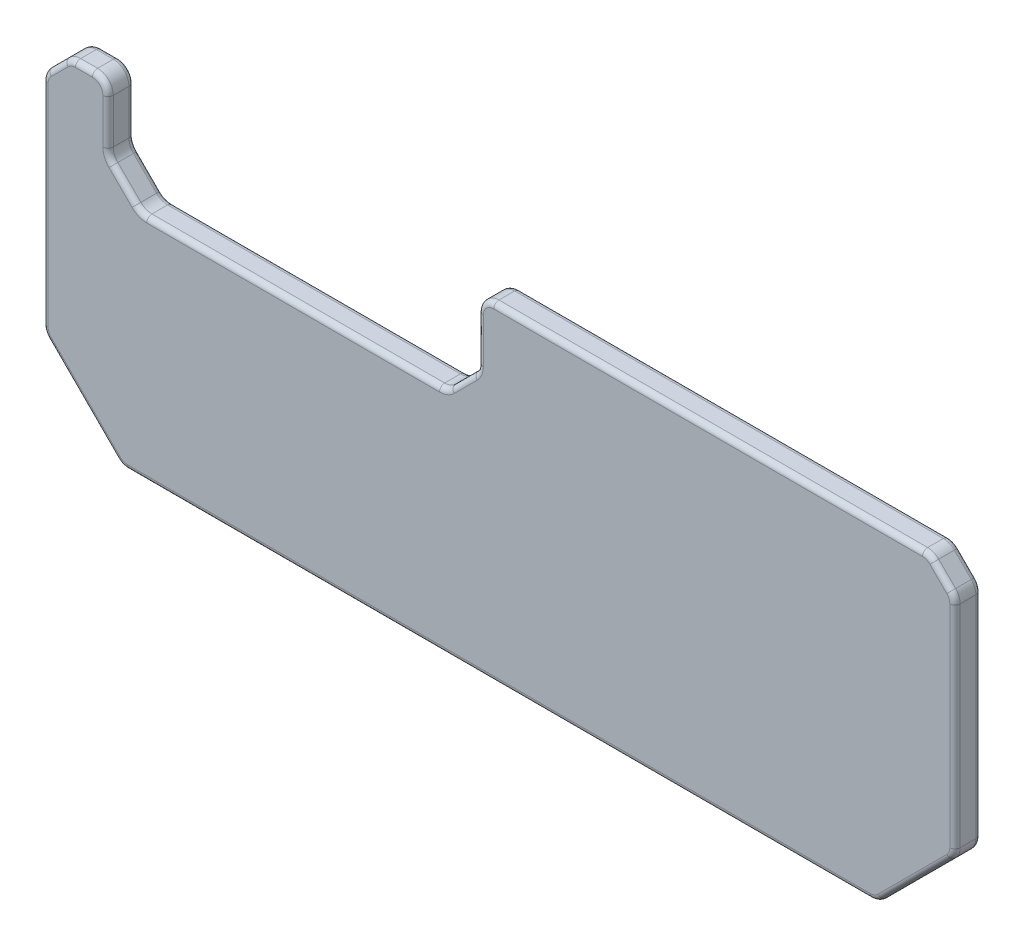
from build123d import *

# Parameters (mm, degrees)
SKETCH_1_W          = 175
SKETCH_1_H          = 63
EXTRUDE_1_DEPTH     = 5
CUT_EXTRUDE_1_DEPTH = 5
CHAMFER_1_SIZE      = 15
CHAMFER_2_SIZE      = 5
EXTRUDE_START       = -7
EXTRUDE_2_DEPTH     = 25
EXTRUDE_START_2     = -12
SKETCH_5_W          = 68
SKETCH_5_H          = 5
SKETCH_5_W_2        = 70
EXTRUDE_4_DEPTH     = 2
FILLET_1_R          = 3
FILLET_2_R          = 3
FILLET_3_R          = 1


with BuildPart() as part:
    # 草图1 → 凸台-拉伸1 (new body)
    with BuildSketch(Plane.XY):
        with Locations((0, 24.5)):
            Rectangle(SKETCH_1_W, SKETCH_1_H)
    extrude(amount=EXTRUDE_1_DEPTH)

    # 草图2 → 切除-拉伸1 (cut)
    with BuildSketch(Plane.XY.offset(5)):
        Polygon((-75, 56), (-4, 56), (-4, 43.171572875), (-10.171572875, 37), (-68.828427125, 37), (-75, 43.171572875), align=None)
    extrude(amount=-CUT_EXTRUDE_1_DEPTH, mode=Mode.SUBTRACT)

    # 倒角1
    chamfer_1_edges = [part.edges().sort_by_distance(p)[0] for p in [
        (87.5, -7, 2.5),
        (-87.5, -7, 2.5),
    ]]
    chamfer(chamfer_1_edges, length=CHAMFER_1_SIZE)

    # 倒角2
    chamfer_2_edges = [part.edges().sort_by_distance(p)[0] for p in [
        (-87.5, 56, 2.5),
        (87.5, 56, 2.5),
    ]]
    chamfer(chamfer_2_edges, length=CHAMFER_2_SIZE)

    # 草图4 → 凸台-拉伸2 (add)
    with BuildSketch(Plane.XZ.offset(7).offset(EXTRUDE_START)):
        Polygon((-23.5, -3), (-53.5, -3), (-51.767949192, 0), (-25.232050808, 0), align=None)
        Polygon((23.5, -3), (25.232050808, 0), (51.767949192, 0), (53.5, -3), align=None)
    extrude(amount=-EXTRUDE_2_DEPTH)

    # 草图5 → 凸台-拉伸4 (add)
    with BuildSketch(Plane(origin=(0, 37, 0), x_dir=(1, 0, 0), z_dir=(0, 1, 0)).offset(EXTRUDE_START_2)):
        with Locations((-39.5, 2.5)):
            Rectangle(SKETCH_5_W, SKETCH_5_H)
        with Locations((38.5, 2.5)):
            Rectangle(SKETCH_5_W_2, SKETCH_5_H)
    extrude(amount=-EXTRUDE_4_DEPTH)

    # 圆角1
    fillet_1_edges = [part.edges().sort_by_distance(p)[0] for p in [
        (-4, 43.171572875, 2.5),
        (-10.171572875, 37, 2.5),
        (-68.828427125, 37, 2.5),
        (-75, 43.171572875, 2.5),
        (-75, 56, 2.5),
        (-4, 56, 2.5),
        (72.5, -7, 2.5),
        (-72.5, -7, 2.5),
        (-87.5, 8, 2.5),
        (87.5, 8, 2.5),
        (82.5, 56, 2.5),
        (87.5, 51, 2.5),
        (-82.5, 56, 2.5),
    ]]
    fillet(fillet_1_edges, radius=FILLET_1_R)

    # 圆角2
    fillet_2_edges = [part.edges().sort_by_distance(p)[0] for p in [
        (-87.5, 51, 2.5),
    ]]
    fillet(fillet_2_edges, radius=FILLET_2_R)

    # 圆角3
    fillet_3_edges = [part.edges().sort_by_distance(p)[0] for p in [
        (40.128679656, 56, 5),
        (40.128679656, 56, 0),
        (87.5, 29.5, 5),
        (85, 53.5, 5),
        (-4, 48.707106781, 5),
        (-7.085786438, 40.085786438, 5),
        (-39.5, 37, 5),
        (-71.914213562, 40.085786438, 5),
        (-75, 48.707106781, 5),
        (-79.628679656, 56, 5),
        (-85, 53.5, 5),
        (-80, 0.5, 5),
        (0, -7, 5),
        (80, 0.5, 5),
        (-82.40540961, 55.771638598, 5),
        (-87.271638598, 8.09459039, 5),
        (-72.40540961, -6.771638598, 5),
        (82.40540961, 55.771638598, 5),
        (87.271638598, 50.90540961, 5),
        (87.271638598, 8.09459039, 5),
        (72.40540961, -6.771638598, 5),
        (-75.878679656, 55.121320344, 5),
        (-3.121320344, 55.121320344, 5),
        (-4, 48.707106781, 0),
        (85, 53.5, 0),
        (87.5, 29.5, 0),
        (80, 0.5, 0),
        (0, -7, 0),
        (-80, 0.5, 0),
        (-79.628679656, 56, 0),
        (-75, 48.707106781, 0),
        (-71.914213562, 40.085786438, 0),
        (-39.5, 37, 0),
        (-7.085786438, 40.085786438, 0),
        (-82.40540961, 55.771638598, 0),
        (-87.271638598, 8.09459039, 0),
        (-72.40540961, -6.771638598, 0),
        (82.40540961, 55.771638598, 0),
        (87.271638598, 50.90540961, 0),
        (87.271638598, 8.09459039, 0),
        (72.40540961, -6.771638598, 0),
        (-75.878679656, 55.121320344, 0),
        (-3.121320344, 55.121320344, 0),
        (-4.228361402, 43.266163265, 5),
        (-4.228361402, 43.266163265, 0),
        (-10.266163265, 37.228361402, 5),
        (-10.266163265, 37.228361402, 0),
        (-68.733836735, 37.228361402, 5),
        (-68.733836735, 37.228361402, 0),
        (-74.771638598, 43.266163265, 5),
        (-74.771638598, 43.266163265, 0),
        (-87.5, 29.5, 0),
        (-87.5, 29.5, 5),
        (-85, 53.5, 0),
        (-87.271638598, 50.90540961, 0),
        (-87.271638598, 50.90540961, 5),
    ]]
    fillet(fillet_3_edges, radius=FILLET_3_R)


solid = part.part
